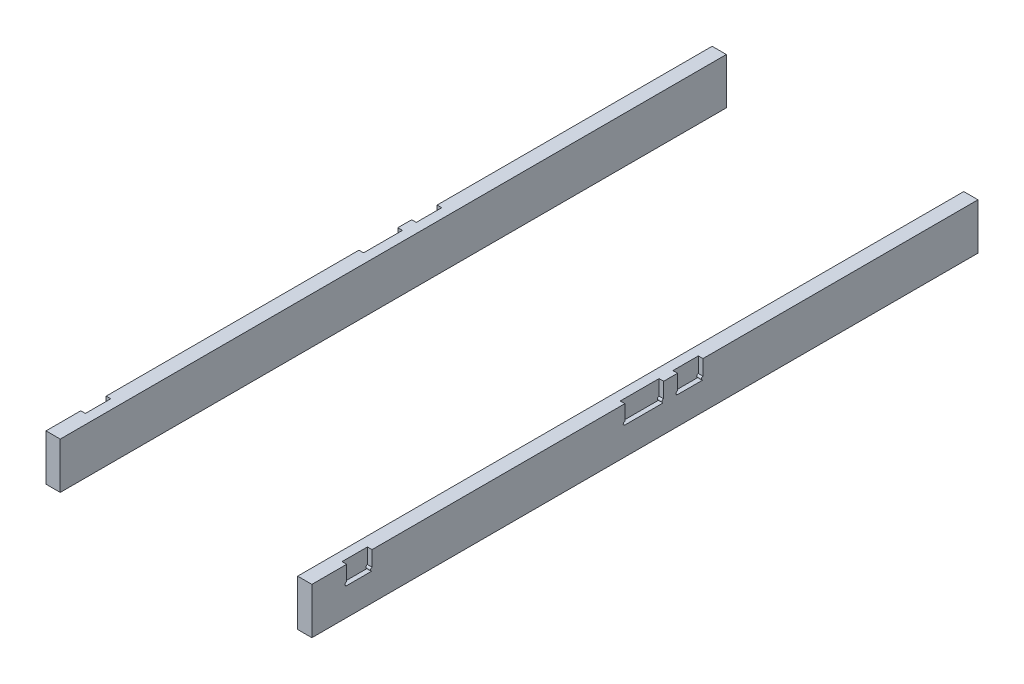
from build123d import *

# Parameters (mm, degrees)
SKETCH8_W           = 1440.8
SKETCH8_H           = 100
BOSS_EXTRUDE2_DEPTH = 30.8
CUT_EXTRUDE4_DEPTH  = 10
CUT_EXTRUDE5_DEPTH  = 10
CUT_EXTRUDE6_DEPTH  = 10
SKETCH16_W          = 1440.8
SKETCH16_H          = 100
BOSS_EXTRUDE3_DEPTH = 30.8
CUT_EXTRUDE7_DEPTH  = 10
CUT_EXTRUDE8_DEPTH  = 10
CUT_EXTRUDE9_START  = -10
CUT_EXTRUDE9_DEPTH  = 10


with BuildPart() as part:
    # Sketch8 → Boss-Extrude2 (new body)
    with BuildSketch(Plane.ZY.offset(287.55)):
        with Locations((751.2, -450)):
            Rectangle(SKETCH8_W, SKETCH8_H)
    extrude(amount=-BOSS_EXTRUDE2_DEPTH)

    # Sketch9 → Cut-Extrude4 (cut)
    with BuildSketch(Plane.ZY.offset(287.55)):
        with BuildLine():
            Line((680.67, -433), (680.67, -400))
            Line((680.67, -400), (625.67, -400))
            Line((625.67, -400), (625.67, -433))
            ThreePointArc((625.67, -433), (622.17, -436.5), (625.67, -440))
            Line((625.67, -440), (680.67, -440))
            ThreePointArc((680.67, -440), (684.17, -436.5), (680.67, -433))
        make_face()
    extrude(amount=-CUT_EXTRUDE4_DEPTH, mode=Mode.SUBTRACT)

    # Sketch10 → Cut-Extrude5 (cut)
    with BuildSketch(Plane.ZY.offset(287.55)):
        with BuildLine():
            Line((794.66, -433.034858241), (794.66, -400))
            Line((794.66, -400), (710.67, -400))
            Line((710.67, -400), (710.67, -433.083437478))
            ThreePointArc((710.67, -433.083437478), (713.389406768, -436.882119858), (709.91032867, -440))
            Line((709.91032867, -440), (795.152739883, -440))
            ThreePointArc((795.152739883, -440), (798.644014447, -436.253014328), (794.66, -433.034858241))
        make_face()
    extrude(amount=-CUT_EXTRUDE5_DEPTH, mode=Mode.SUBTRACT)

    # Sketch11 → Cut-Extrude6 (cut)
    with BuildSketch(Plane.ZY.offset(287.55)):
        with BuildLine():
            Line((1396.47, -433.034858241), (1396.47, -400))
            Line((1396.47, -400), (1341.47, -400))
            Line((1341.47, -400), (1341.47, -433.083437478))
            ThreePointArc((1341.47, -433.083437478), (1344.189406768, -436.882119858), (1340.71032867, -440))
            Line((1340.71032867, -440), (1396.962739883, -440))
            ThreePointArc((1396.962739883, -440), (1400.454014447, -436.253014328), (1396.47, -433.034858241))
        make_face()
    extrude(amount=-CUT_EXTRUDE6_DEPTH, mode=Mode.SUBTRACT)


with BuildPart() as body_2:
    # Sketch16 → Boss-Extrude3 (new body)
    with BuildSketch(Plane(origin=(287.55, 0, 0), x_dir=(0, 0, -1), z_dir=(1, 0, 0))):
        with Locations((-751.2, -450)):
            Rectangle(SKETCH16_W, SKETCH16_H)
    extrude(amount=-BOSS_EXTRUDE3_DEPTH)

    # Sketch17 → Cut-Extrude7 (cut)
    with BuildSketch(Plane(origin=(287.55, 0, 0), x_dir=(0, 0, -1), z_dir=(1, 0, 0))):
        with BuildLine():
            Line((-1396.4, -400), (-1396.4, -433))
            ThreePointArc((-1396.4, -433), (-1399.9, -436.5), (-1396.4, -440))
            Line((-1396.4, -440), (-1341.4, -440))
            ThreePointArc((-1341.4, -440), (-1344.9, -436.5), (-1341.4, -433))
            Line((-1341.4, -433), (-1341.4, -400))
            Line((-1341.4, -400), (-1396.4, -400))
        make_face()
    extrude(amount=-CUT_EXTRUDE7_DEPTH, mode=Mode.SUBTRACT)

    # Sketch18 → Cut-Extrude8 (cut)
    with BuildSketch(Plane(origin=(287.55, 0, 0), x_dir=(0, 0, -1), z_dir=(1, 0, 0))):
        with BuildLine():
            Line((-794.65, -400), (-794.65, -433))
            ThreePointArc((-794.65, -433), (-798.15, -436.5), (-794.65, -440))
            Line((-794.65, -440), (-710.66, -440))
            ThreePointArc((-710.66, -440), (-714.16, -436.5), (-710.66, -433))
            Line((-710.66, -433), (-710.66, -400))
            Line((-710.66, -400), (-794.65, -400))
        make_face()
    extrude(amount=-CUT_EXTRUDE8_DEPTH, mode=Mode.SUBTRACT)

    # Sketch19 → Cut-Extrude9 (cut)
    with BuildSketch(Plane(origin=(287.55, 0, 0), x_dir=(0, 0, -1), z_dir=(1, 0, 0)).offset(CUT_EXTRUDE9_START)):
        with BuildLine():
            Line((-680.67, -400), (-680.67, -433))
            ThreePointArc((-680.67, -433), (-684.17, -436.5), (-680.67, -440))
            Line((-680.67, -440), (-625.67, -440))
            ThreePointArc((-625.67, -440), (-629.17, -436.5), (-625.67, -433))
            Line((-625.67, -433), (-625.67, -400))
            Line((-625.67, -400), (-680.67, -400))
        make_face()
    extrude(amount=CUT_EXTRUDE9_DEPTH, mode=Mode.SUBTRACT)


solid = Compound([part.part, body_2.part])
